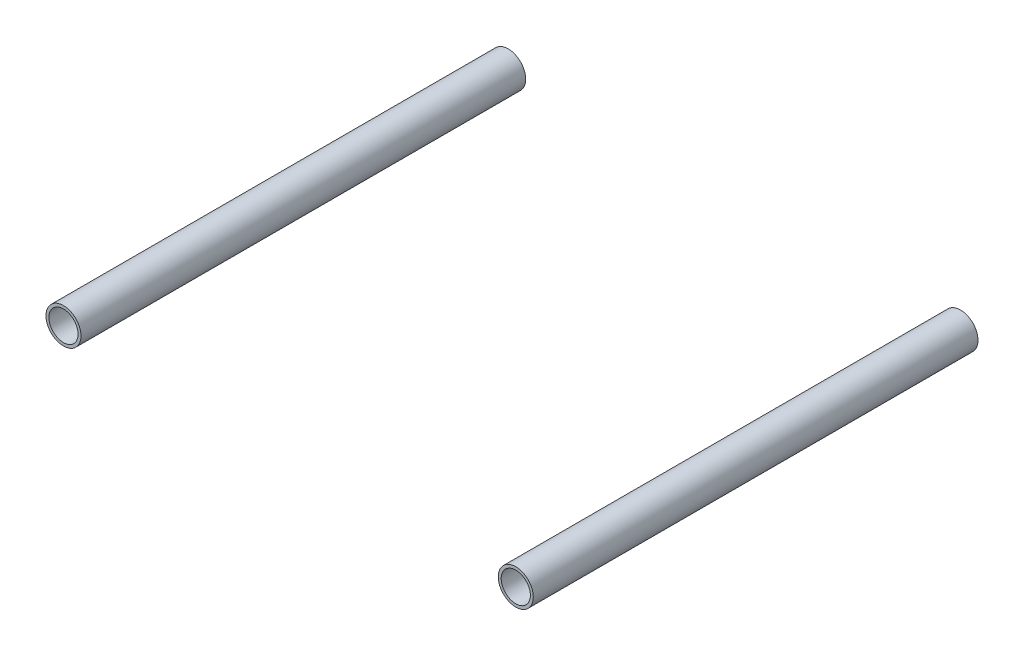
from build123d import *

# Parameters (mm, degrees)
SKETCH1_R             = 6
SKETCH1_R_2           = 5
BOSS_EXTRUDE1_DEPTH   = 76.2
BOSS_EXTRUDE1_2_DEPTH = 76.2


with BuildPart() as part:
    # Sketch1 → Boss-Extrude1 (new, symmetric)
    with BuildSketch(Plane.XY):
        with Locations((-77.5, 0)):
            Circle(SKETCH1_R)
        with Locations((-77.5, 0)):
            Circle(SKETCH1_R_2, mode=Mode.SUBTRACT)
    extrude(amount=BOSS_EXTRUDE1_DEPTH, both=True)


with BuildPart() as body_2:
    # Sketch1 → Boss-Extrude1 2 (new, symmetric)
    with BuildSketch(Plane.XY):
        with Locations((77.5, 0)):
            Circle(SKETCH1_R)
        with Locations((77.5, 0)):
            Circle(SKETCH1_R_2, mode=Mode.SUBTRACT)
    extrude(amount=BOSS_EXTRUDE1_2_DEPTH, both=True)


solid = Compound([part.part, body_2.part])
